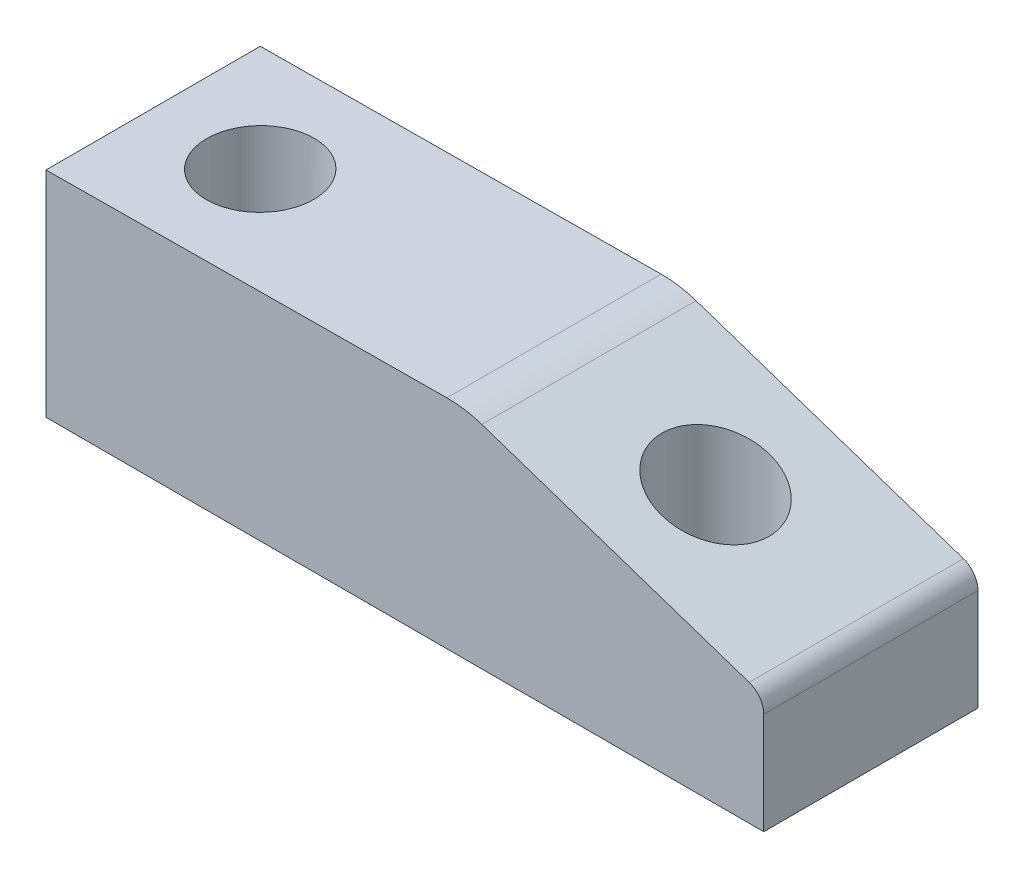
from build123d import *

# Parameters (mm, degrees)
BOSS_EXTRUDE1_DEPTH = 20
SKETCH4_R           = 6
CUT_EXTRUDE11_DEPTH = 142.431949953
CUT_EXTRUDE12_START = 10
SKETCH4_13_R        = 10
SKETCH4_13_R_2      = 6
CUT_EXTRUDE12_DEPTH = 132.431949953


with BuildPart() as part:
    # Sketch1 → Boss-Extrude1 (new, symmetric)
    with BuildSketch(Plane.XY):
        with BuildLine():
            Line((0, 0), (0, 40))
            Line((0, 40), (74.844322004, 40.582598355))
            ThreePointArc((74.844322004, 40.582598355), (78.147309148, 40.334012976), (81.36396939, 39.543686675))
            Line((81.36396939, 39.543686675), (131.272793878, 22.792096484))
            ThreePointArc((131.272793878, 22.792096484), (133.247397074, 21.335468314), (134, 19))
            Line((134, 19), (134, 0))
            Line((134, 0), (0, 0))
        make_face()
    extrude(amount=BOSS_EXTRUDE1_DEPTH, both=True)

    # Sketch4 → Cut-Extrude11 (cut, through all)
    with BuildSketch(Plane(origin=(0, 0, 0), x_dir=(1, 0, 0), z_dir=(0, 1, 0))):
        with Locations((20, 0)):
            Circle(SKETCH4_R)
        with Locations((105, 0)):
            Circle(SKETCH4_R)
    extrude(amount=CUT_EXTRUDE11_DEPTH, mode=Mode.SUBTRACT)

    # Sketch4<13> → Cut-Extrude12 (cut, through all)
    # profile 1 of 2: a face of its own
    with BuildSketch(Plane(origin=(0, 0, 0), x_dir=(1, 0, 0), z_dir=(0, 1, 0)).offset(CUT_EXTRUDE12_START)):
        with Locations((20, 0)):
            Circle(SKETCH4_13_R)
        with Locations((20, 0)):
            Circle(SKETCH4_13_R_2, mode=Mode.SUBTRACT)
    # profile 2 of 2: a face of its own
    with BuildSketch(Plane(origin=(0, 0, 0), x_dir=(1, 0, 0), z_dir=(0, 1, 0)).offset(CUT_EXTRUDE12_START)):
        with Locations((105, 0)):
            Circle(SKETCH4_13_R)
        with Locations((105, 0)):
            Circle(SKETCH4_13_R_2, mode=Mode.SUBTRACT)
    extrude(amount=CUT_EXTRUDE12_DEPTH, mode=Mode.SUBTRACT)


solid = part.part
